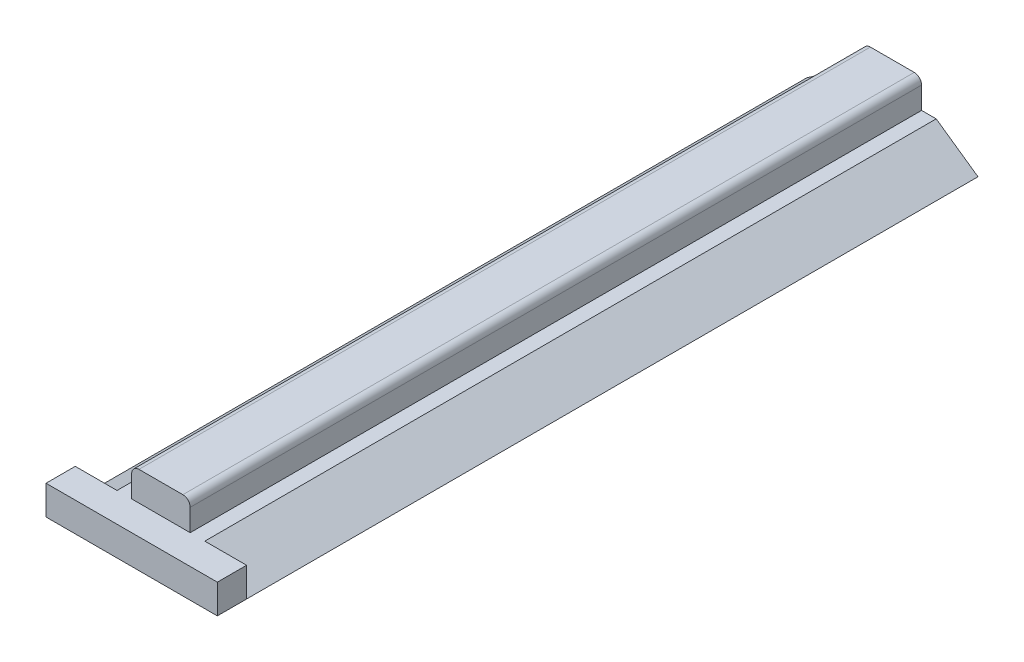
from build123d import *

# Parameters (mm, degrees)
BOSS_EXTRUDE1_DEPTH = 25
SKETCH2_W           = 5.856296014
SKETCH2_H           = 1
BOSS_EXTRUDE2_DEPTH = 1
SKETCH3_W           = 2
SKETCH3_H           = 25
BOSS_EXTRUDE3_DEPTH = 1
FILLET1_R           = 0.25


with BuildPart() as part:
    # Sketch1 → Boss-Extrude1 (new body)
    with BuildSketch(Plane.XY):
        Polygon((0, 0), (-1.428148007, -1), (4.428148007, -1), (3, 0), align=None)
    extrude(amount=BOSS_EXTRUDE1_DEPTH)

    # Sketch2 → Boss-Extrude2 (add)
    with BuildSketch(Plane.XY.offset(25)):
        with Locations((1.5, -0.5)):
            Rectangle(SKETCH2_W, SKETCH2_H)
    extrude(amount=BOSS_EXTRUDE2_DEPTH)

    # Sketch3 → Boss-Extrude3 (add)
    with BuildSketch(Plane(origin=(0, 0, 0), x_dir=(1, 0, 0), z_dir=(0, 1, 0))):
        with Locations((1.5, -12.5)):
            Rectangle(SKETCH3_W, SKETCH3_H)
    extrude(amount=BOSS_EXTRUDE3_DEPTH)

    # Fillet1
    fillet1_edges = [part.edges().sort_by_distance(p)[0] for p in [
        (0.5, 1, 12.5),
        (2.5, 1, 12.5),
    ]]
    fillet(fillet1_edges, radius=FILLET1_R)


solid = part.part
